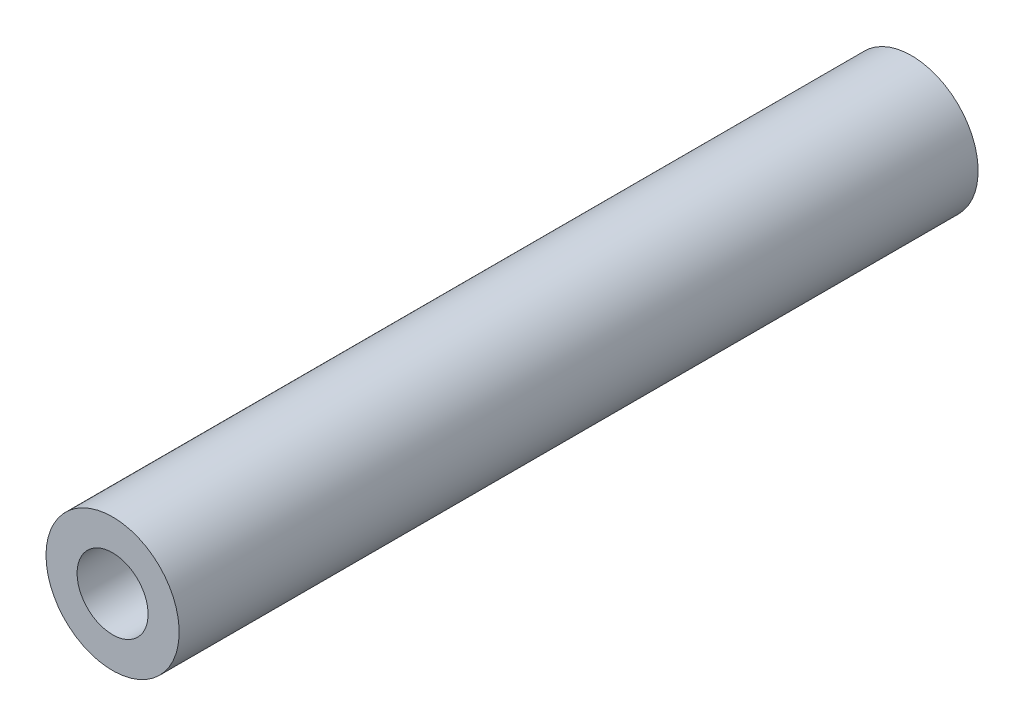
from build123d import *

# Parameters (mm, degrees)
SKETCH1_R           = 15
SKETCH1_R_2         = 8
BOSS_EXTRUDE1_DEPTH = 180


with BuildPart() as part:
    # Sketch1 → Boss-Extrude1 (new body)
    with BuildSketch(Plane.XY):
        with Locations(Location((0, 0, 0), (0, 0, 180))):
            Circle(SKETCH1_R)
        with Locations(Location((0, 0, 0), (0, 0, 180))):
            Circle(SKETCH1_R_2, mode=Mode.SUBTRACT)
    extrude(amount=BOSS_EXTRUDE1_DEPTH)


solid = part.part
